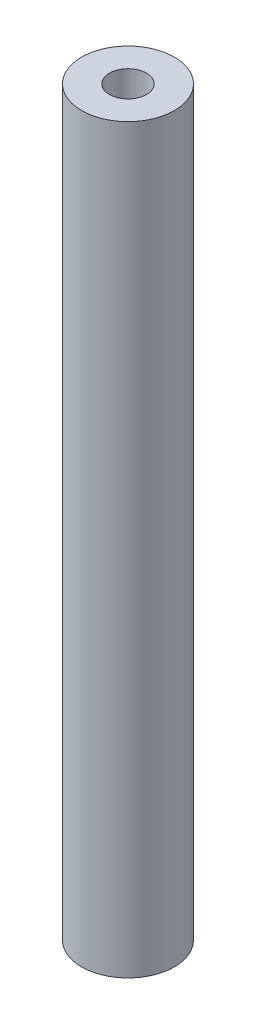
from build123d import *

# Parameters (mm, degrees)
SKETCH1_R           = 2.5
SKETCH1_R_2         = 1
BOSS_EXTRUDE1_DEPTH = 40


with BuildPart() as part:
    # Sketch1 → Boss-Extrude1 (new body)
    with BuildSketch(Plane(origin=(0, 0, 0), x_dir=(1, 0, 0), z_dir=(0, 1, 0))):
        with Locations(Location((0, 0, 0), (0, 0, 270))):
            Circle(SKETCH1_R)
        with Locations(Location((0, 0, 0), (0, 0, 270))):
            Circle(SKETCH1_R_2, mode=Mode.SUBTRACT)
    extrude(amount=BOSS_EXTRUDE1_DEPTH)


solid = part.part
